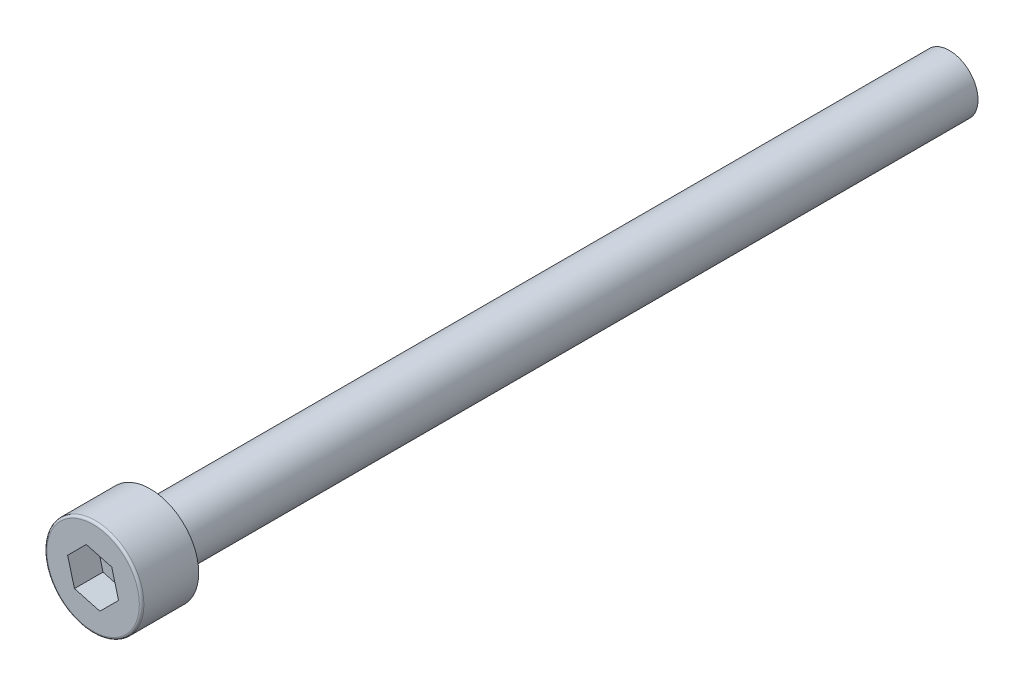
from build123d import *

# Parameters (mm, degrees)
SKETCH_1_R          = 4.25
EXTRUDE_1_DEPTH     = 5
CUT_EXTRUDE_1_DEPTH = 2.5
SKETCH_3_R          = 2.5
EXTRUDE_2_DEPTH     = 70
FILLET_1_R          = 0.2


with BuildPart() as part:
    # 草图1 → 凸台-拉伸1 (new body)
    with BuildSketch(Plane.XY):
        Circle(SKETCH_1_R)
    extrude(amount=EXTRUDE_1_DEPTH)

    # 草图2 → 切除-拉伸1 (cut)
    with BuildSketch(Plane.XY.offset(5)):
        Polygon((-1.632993162, -1.632993162), (0.597716981, -2.230710143), (2.230710143, -0.597716981), (1.632993162, 1.632993162), (-0.597716981, 2.230710143), (-2.230710143, 0.597716981), align=None)
    extrude(amount=-CUT_EXTRUDE_1_DEPTH, mode=Mode.SUBTRACT)

    # 草图3 → 凸台-拉伸2 (add)
    with BuildSketch(Plane(origin=(0, 0, 0), x_dir=(-1, 0, 0), z_dir=(0, 0, -1))):
        with Locations(Location((0, 0, 0), (0, 0, 180))):
            Circle(SKETCH_3_R)
    extrude(amount=EXTRUDE_2_DEPTH)

    # 圆角1
    fillet_1_edges = [part.edges().sort_by_distance(p)[0] for p in [
        (-4.25, 0, 5),
    ]]
    fillet(fillet_1_edges, radius=FILLET_1_R)


solid = part.part
